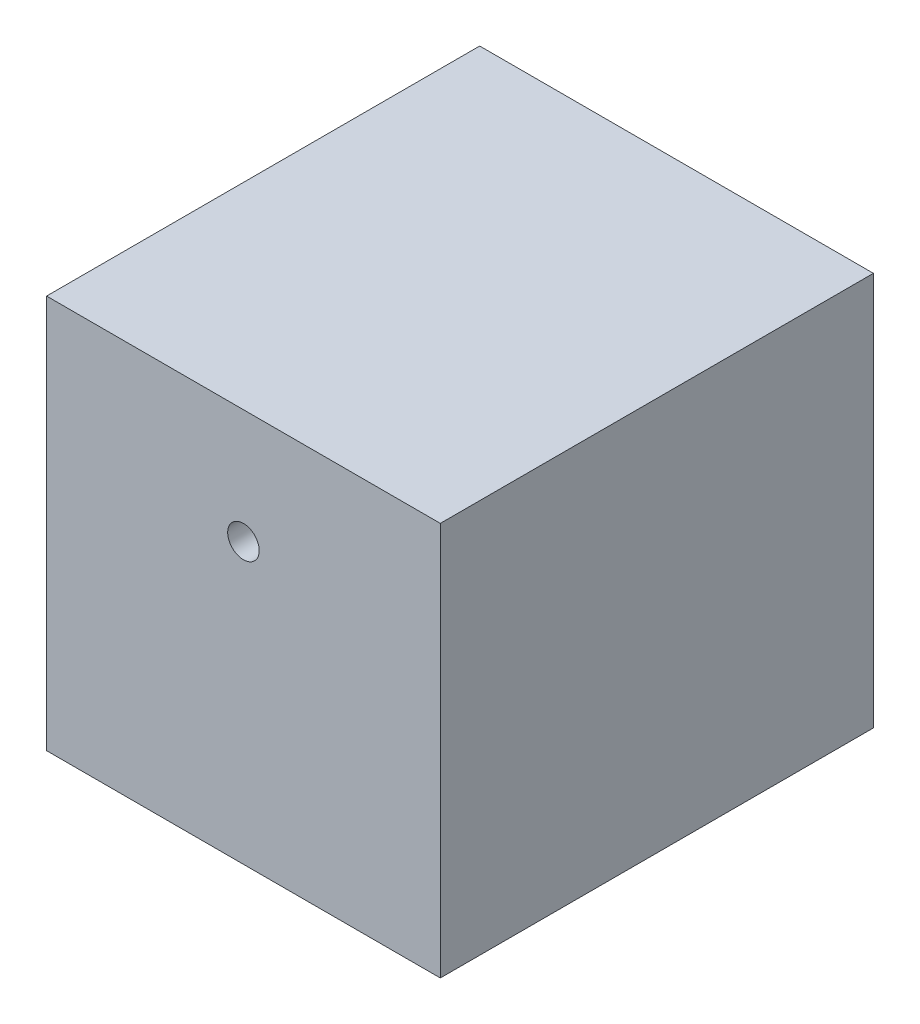
from build123d import *

# Parameters (mm, degrees)
SKETCH1_W           = 10
SKETCH1_H           = 10
BOSS_EXTRUDE1_DEPTH = 11
SKETCH2_R           = 0.4
CUT_EXTRUDE1_DEPTH  = 7


with BuildPart() as part:
    # Sketch1 → Boss-Extrude1 (new body)
    with BuildSketch(Plane.XY):
        with Locations((5, 5)):
            Rectangle(SKETCH1_W, SKETCH1_H)
    extrude(amount=BOSS_EXTRUDE1_DEPTH)

    # Sketch2 → Cut-Extrude1 (cut)
    with BuildSketch(Plane.XY.offset(11)):
        with Locations((5, 7.1)):
            Circle(SKETCH2_R)
    extrude(amount=-CUT_EXTRUDE1_DEPTH, mode=Mode.SUBTRACT)


solid = part.part
